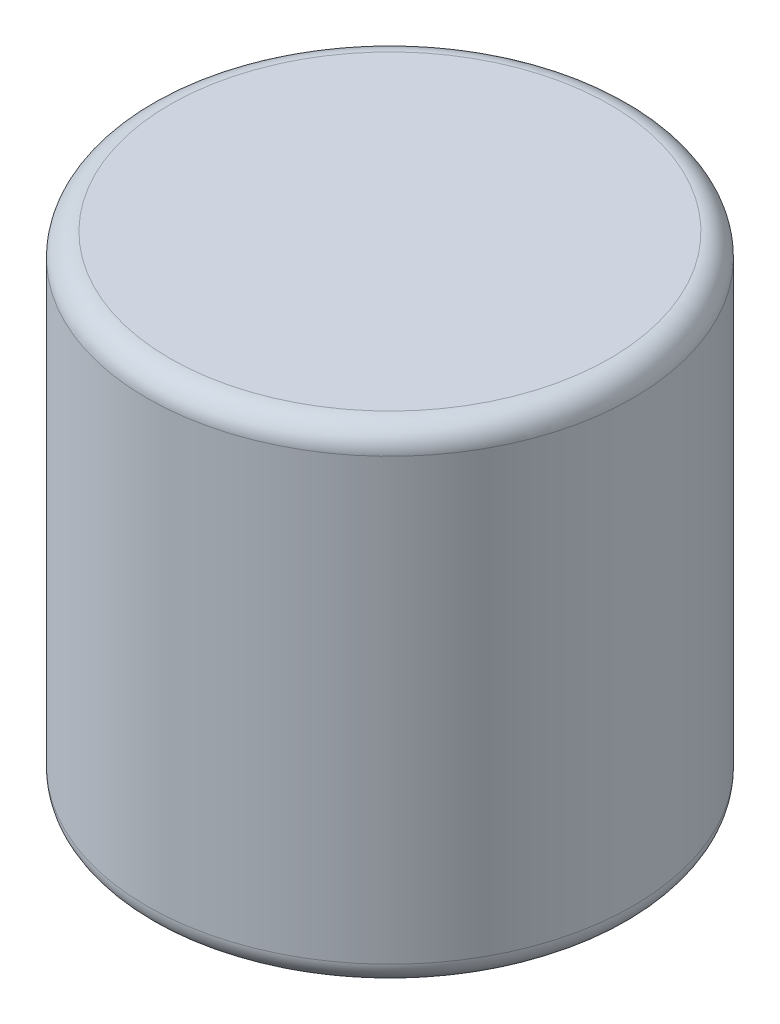
from build123d import *

# Parameters (mm, degrees)
SKETCH1_R           = 3.175
BOSS_EXTRUDE1_DEPTH = 6.35
FILLET3_R           = 0.3


with BuildPart() as part:
    # Sketch1 → Boss-Extrude1 (new body)
    with BuildSketch(Plane(origin=(0, 0, 0), x_dir=(1, 0, 0), z_dir=(0, 1, 0))):
        with Locations(Location((0, 0, 0), (0, 0, 270))):
            Circle(SKETCH1_R)
    extrude(amount=BOSS_EXTRUDE1_DEPTH)

    # Fillet3
    fillet3_edges = [part.edges().sort_by_distance(p)[0] for p in [
        (0, 0, -3.175),
        (0, 6.35, -3.175),
    ]]
    fillet(fillet3_edges, radius=FILLET3_R)


solid = part.part
